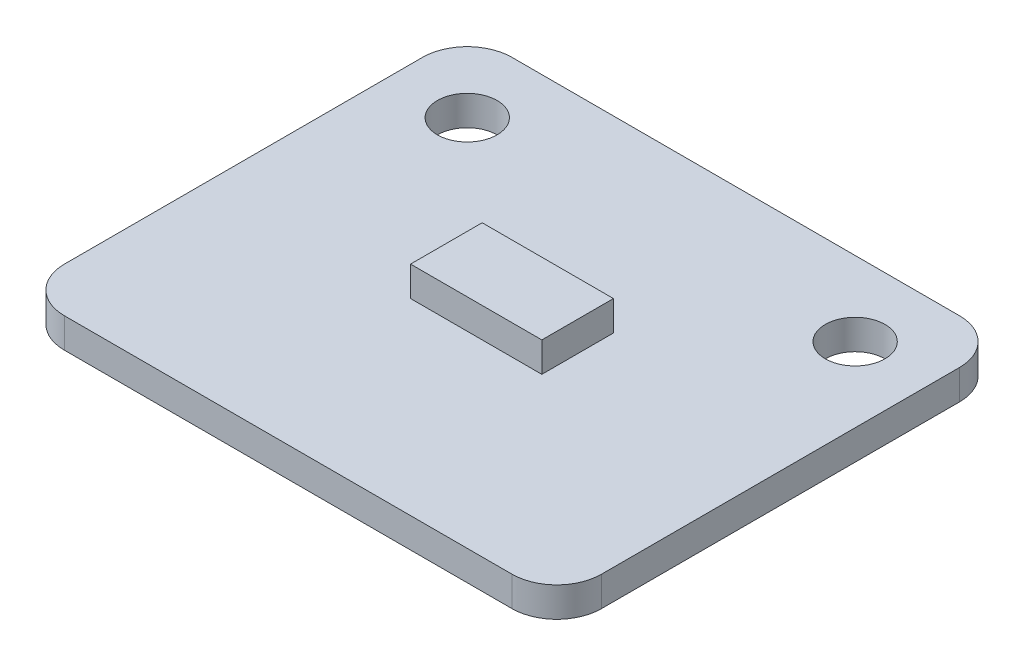
from build123d import *

# Parameters (mm, degrees)
SKETCH1_W           = 18
SKETCH1_H           = 15
SKETCH1_R           = 1
BOSS_EXTRUDE1_DEPTH = 1
SKETCH1_4_W         = 4.4
SKETCH1_4_H         = 2.4
BOSS_EXTRUDE2_DEPTH = 1
FILLET1_R           = 1.5


with BuildPart() as part:
    # Sketch1 → Boss-Extrude1 (new body)
    with BuildSketch(Plane(origin=(0, 0, 0), x_dir=(1, 0, 0), z_dir=(0, 1, 0))):
        Rectangle(SKETCH1_W, SKETCH1_H)
        with Locations((-6.5, 5)):
            Circle(SKETCH1_R, mode=Mode.SUBTRACT)
        with Locations((6.5, 5)):
            Circle(SKETCH1_R, mode=Mode.SUBTRACT)
    extrude(amount=-BOSS_EXTRUDE1_DEPTH)

    # Sketch1<4> → Boss-Extrude2 (add)
    with BuildSketch(Plane(origin=(0, 0, 0), x_dir=(1, 0, 0), z_dir=(0, 1, 0))):
        Rectangle(SKETCH1_4_W, SKETCH1_4_H)
    extrude(amount=BOSS_EXTRUDE2_DEPTH)

    # Fillet1
    fillet1_edges = [part.edges().sort_by_distance(p)[0] for p in [
        (-9, -0.5, -7.5),
        (9, -0.5, -7.5),
        (9, -0.5, 7.5),
        (-9, -0.5, 7.5),
    ]]
    fillet(fillet1_edges, radius=FILLET1_R)


solid = part.part
